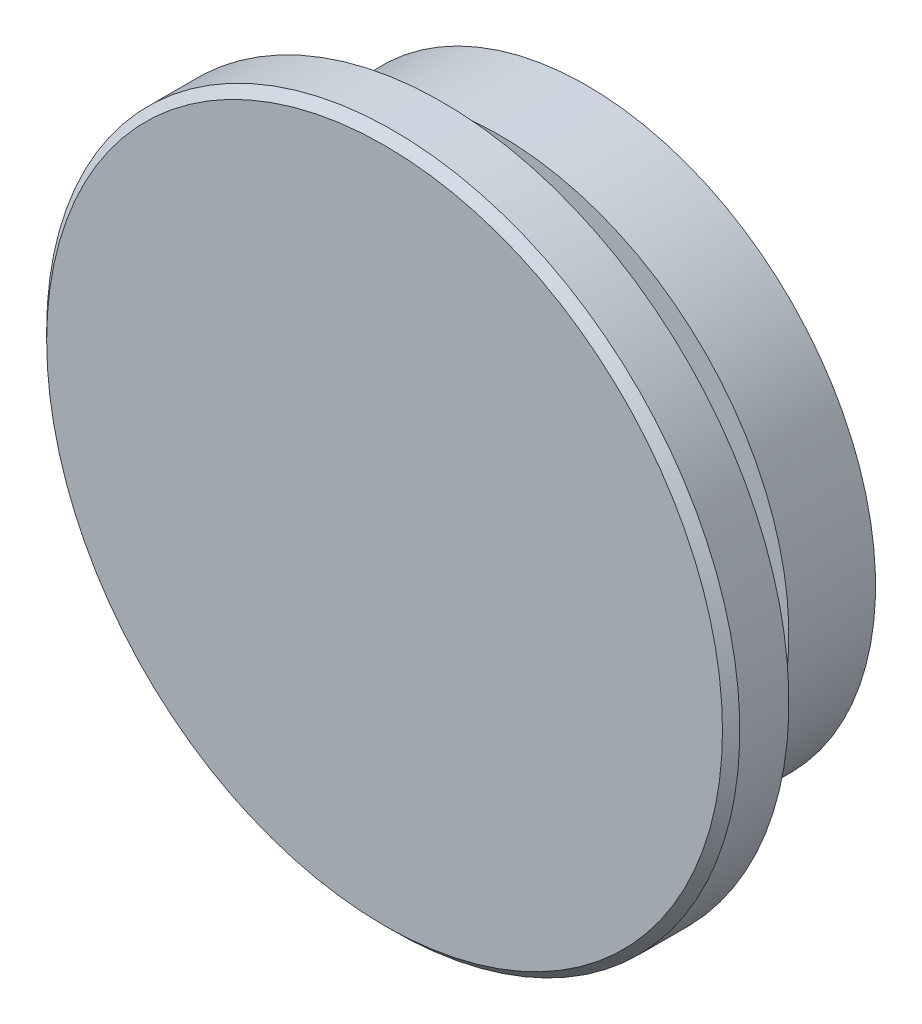
from build123d import *


with BuildPart() as part:
    # Эскиз2 → Повернуть1 (revolve)
    with BuildSketch(Plane(origin=(0, 0, 0), x_dir=(1, 0, 0), z_dir=(0, 1, 0))):
        Polygon((0, 0), (-11.7, 0), (-12, 0.3), (-12, 2), (-9, 2), (-9, 4), (-10, 4), (-10, 7), (-7.5, 7), (-7.5, 5.5), (0, 5.5), align=None)
    revolve(axis=Axis((0, 0, -5.5), (0, 0, 1)))


solid = part.part
